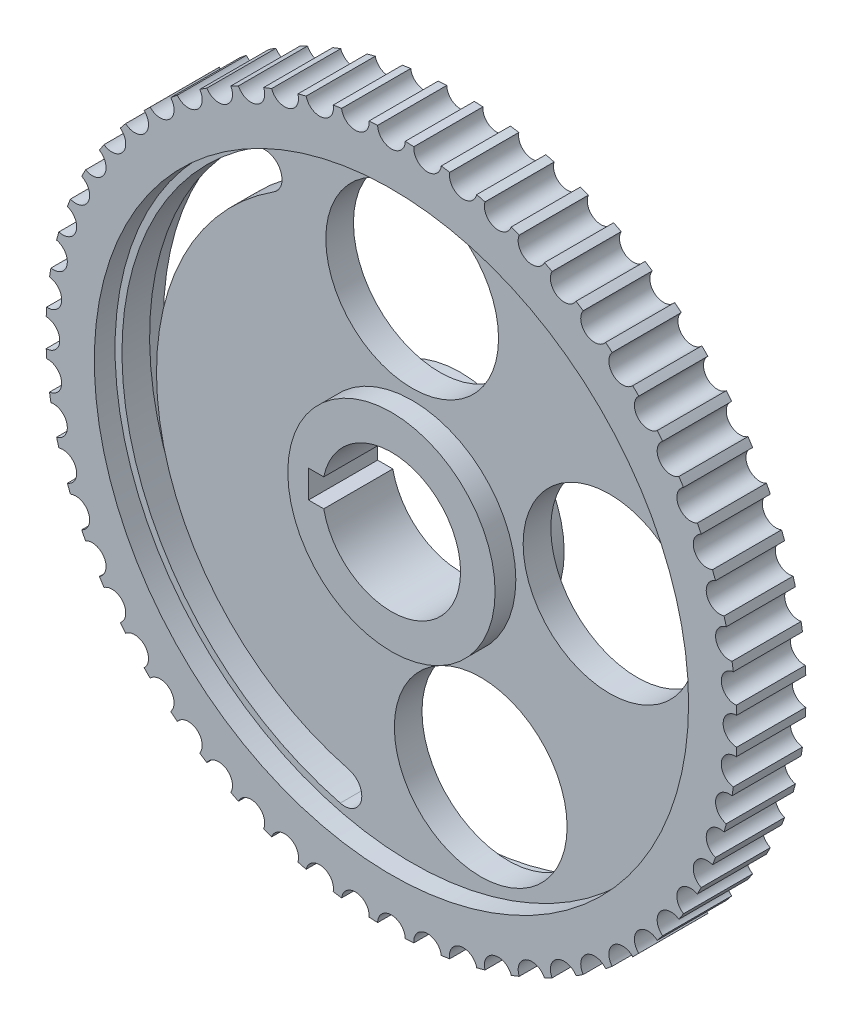
from build123d import *

# Parameters (mm, degrees)
SKETCH1_R           = 50
BOSS_EXTRUDE1_DEPTH = 10
SKETCH2_R           = 2
CUT_EXTRUDE1_DEPTH  = 10
SKETCH3_R           = 43
CUT_EXTRUDE2_DEPTH  = 3
CUT_EXTRUDE3_START  = -3
SKETCH4_R           = 43
CUT_EXTRUDE3_DEPTH  = 3
SKETCH7_R           = 15
BOSS_EXTRUDE2_DEPTH = 3
BOSS_EXTRUDE3_START = 3
SKETCH8_R           = 15
BOSS_EXTRUDE3_DEPTH = 3
SKETCH9_R           = 12.5
CUT_EXTRUDE4_DEPTH  = 5
CUT_EXTRUDE5_DEPTH  = 5
CUT_EXTRUDE7_DEPTH  = 10


with BuildPart() as part:
    # Sketch1 → Boss-Extrude1 (new body)
    with BuildSketch(Plane.XY):
        Circle(SKETCH1_R)
    extrude(amount=BOSS_EXTRUDE1_DEPTH)

    # Sketch2 → Cut-Extrude1 (cut)
    with BuildSketch(Plane.XY.offset(10)):
        with Locations((0, 50)):
            Circle(SKETCH2_R)
        with Locations((5.226423163, 49.726094768)):
            Circle(SKETCH2_R)
        with Locations((10.395584541, 48.907380037)):
            Circle(SKETCH2_R)
        with Locations((15.450849719, 47.552825815)):
            Circle(SKETCH2_R)
        with Locations((20.336832154, 45.677272882)):
            Circle(SKETCH2_R)
        with Locations((25, 43.301270189)):
            Circle(SKETCH2_R)
        with Locations((29.389262615, 40.450849719)):
            Circle(SKETCH2_R)
        with Locations((33.456530318, 37.157241274)):
            Circle(SKETCH2_R)
        with Locations((37.157241274, 33.456530318)):
            Circle(SKETCH2_R)
        with Locations((40.450849719, 29.389262615)):
            Circle(SKETCH2_R)
        with Locations((43.301270189, 25)):
            Circle(SKETCH2_R)
        with Locations((45.677272882, 20.336832154)):
            Circle(SKETCH2_R)
        with Locations((47.552825815, 15.450849719)):
            Circle(SKETCH2_R)
        with Locations((48.907380037, 10.395584541)):
            Circle(SKETCH2_R)
        with Locations((49.726094768, 5.226423163)):
            Circle(SKETCH2_R)
        with Locations((50, 0)):
            Circle(SKETCH2_R)
        with Locations((49.726094768, -5.226423163)):
            Circle(SKETCH2_R)
        with Locations((48.907380037, -10.395584541)):
            Circle(SKETCH2_R)
        with Locations((47.552825815, -15.450849719)):
            Circle(SKETCH2_R)
        with Locations((45.677272882, -20.336832154)):
            Circle(SKETCH2_R)
        with Locations((43.301270189, -25)):
            Circle(SKETCH2_R)
        with Locations((40.450849719, -29.389262615)):
            Circle(SKETCH2_R)
        with Locations((37.157241274, -33.456530318)):
            Circle(SKETCH2_R)
        with Locations((33.456530318, -37.157241274)):
            Circle(SKETCH2_R)
        with Locations((29.389262615, -40.450849719)):
            Circle(SKETCH2_R)
        with Locations((25, -43.301270189)):
            Circle(SKETCH2_R)
        with Locations((20.336832154, -45.677272882)):
            Circle(SKETCH2_R)
        with Locations((15.450849719, -47.552825815)):
            Circle(SKETCH2_R)
        with Locations((10.395584541, -48.907380037)):
            Circle(SKETCH2_R)
        with Locations((5.226423163, -49.726094768)):
            Circle(SKETCH2_R)
        with Locations((0, -50)):
            Circle(SKETCH2_R)
        with Locations((-5.226423163, -49.726094768)):
            Circle(SKETCH2_R)
        with Locations((-10.395584541, -48.907380037)):
            Circle(SKETCH2_R)
        with Locations((-15.450849719, -47.552825815)):
            Circle(SKETCH2_R)
        with Locations((-20.336832154, -45.677272882)):
            Circle(SKETCH2_R)
        with Locations((-25, -43.301270189)):
            Circle(SKETCH2_R)
        with Locations((-29.389262615, -40.450849719)):
            Circle(SKETCH2_R)
        with Locations((-33.456530318, -37.157241274)):
            Circle(SKETCH2_R)
        with Locations((-37.157241274, -33.456530318)):
            Circle(SKETCH2_R)
        with Locations((-40.450849719, -29.389262615)):
            Circle(SKETCH2_R)
        with Locations((-43.301270189, -25)):
            Circle(SKETCH2_R)
        with Locations((-45.677272882, -20.336832154)):
            Circle(SKETCH2_R)
        with Locations((-47.552825815, -15.450849719)):
            Circle(SKETCH2_R)
        with Locations((-48.907380037, -10.395584541)):
            Circle(SKETCH2_R)
        with Locations((-49.726094768, -5.226423163)):
            Circle(SKETCH2_R)
        with Locations((-50, 0)):
            Circle(SKETCH2_R)
        with Locations((-49.726094768, 5.226423163)):
            Circle(SKETCH2_R)
        with Locations((-48.907380037, 10.395584541)):
            Circle(SKETCH2_R)
        with Locations((-47.552825815, 15.450849719)):
            Circle(SKETCH2_R)
        with Locations((-45.677272882, 20.336832154)):
            Circle(SKETCH2_R)
        with Locations((-43.301270189, 25)):
            Circle(SKETCH2_R)
        with Locations((-40.450849719, 29.389262615)):
            Circle(SKETCH2_R)
        with Locations((-37.157241274, 33.456530318)):
            Circle(SKETCH2_R)
        with Locations((-33.456530318, 37.157241274)):
            Circle(SKETCH2_R)
        with Locations((-29.389262615, 40.450849719)):
            Circle(SKETCH2_R)
        with Locations((-25, 43.301270189)):
            Circle(SKETCH2_R)
        with Locations((-20.336832154, 45.677272882)):
            Circle(SKETCH2_R)
        with Locations((-15.450849719, 47.552825815)):
            Circle(SKETCH2_R)
        with Locations((-10.395584541, 48.907380037)):
            Circle(SKETCH2_R)
        with Locations((-5.226423163, 49.726094768)):
            Circle(SKETCH2_R)
    extrude(amount=-CUT_EXTRUDE1_DEPTH, mode=Mode.SUBTRACT)

    # Sketch3 → Cut-Extrude2 (cut)
    with BuildSketch(Plane.XY.offset(10)):
        Circle(SKETCH3_R)
    extrude(amount=-CUT_EXTRUDE2_DEPTH, mode=Mode.SUBTRACT)

    # Sketch4 → Cut-Extrude3 (cut)
    with BuildSketch(Plane(origin=(0, 0, 0), x_dir=(-1, 0, 0), z_dir=(0, 0, -1)).offset(CUT_EXTRUDE3_START)):
        with Locations(Location((0, 0, 0), (0, 0, 180))):
            Circle(SKETCH4_R)
    extrude(amount=CUT_EXTRUDE3_DEPTH, mode=Mode.SUBTRACT)

    # Sketch7 → Boss-Extrude2 (add)
    with BuildSketch(Plane.XY.offset(7)):
        Circle(SKETCH7_R)
    extrude(amount=BOSS_EXTRUDE2_DEPTH)

    # Sketch8 → Boss-Extrude3 (add)
    with BuildSketch(Plane(origin=(0, 0, 3), x_dir=(-1, 0, 0), z_dir=(0, 0, -1)).offset(BOSS_EXTRUDE3_START)):
        with Locations(Location((0, 0, 0), (0, 0, 180))):
            Circle(SKETCH8_R)
    extrude(amount=-BOSS_EXTRUDE3_DEPTH)

    # Sketch9 → Cut-Extrude4 (cut)
    with BuildSketch(Plane(origin=(0, 0, 3), x_dir=(-1, 0, 0), z_dir=(0, 0, -1))):
        with Locations((0, 29)):
            Circle(SKETCH9_R)
        with Locations((-28.559424837, 5.035797152)):
            Circle(SKETCH9_R)
        with Locations((-9.918584156, -27.251086003)):
            Circle(SKETCH9_R)
    extrude(amount=-CUT_EXTRUDE4_DEPTH, mode=Mode.SUBTRACT)

    # Sketch10 → Cut-Extrude5 (cut)
    with BuildSketch(Plane(origin=(0, 0, 3), x_dir=(-1, 0, 0), z_dir=(0, 0, -1))):
        with BuildLine():
            ThreePointArc((19.987822366, 31.136585508), (36.526926332, -5.89776676), (9.172746005, -35.844954048))
            ThreePointArc((9.172746005, -35.844954048), (7.370569786, -38.886690538), (10.412306276, -40.688866758))
            ThreePointArc((10.412306276, -40.688866758), (41.462997458, -6.694762268), (22.688879442, 35.344232198))
            ThreePointArc((22.688879442, 35.344232198), (19.234527559, 34.590937391), (19.987822366, 31.136585508))
        make_face()
    extrude(amount=-CUT_EXTRUDE5_DEPTH, mode=Mode.SUBTRACT)

    # Sketch11 → Cut-Extrude7 (cut)
    with BuildSketch(Plane(origin=(0, 0, 0), x_dir=(-1, 0, 0), z_dir=(0, 0, -1))):
        with BuildLine():
            Line((8, -2), (8, 2))
            Line((8, 2), (9.797958971, 2))
            ThreePointArc((9.797958971, 2), (-10, 0), (9.797958971, -2))
            Line((9.797958971, -2), (8, -2))
        make_face()
        with BuildLine():
            Line((9.797958971, 2), (8, 2))
            Line((8, 2), (8, -2))
            Line((8, -2), (9.797958971, -2))
            ThreePointArc((9.797958971, -2), (9.94936153, -1.00508962), (10, 0))
            ThreePointArc((10, 0), (9.94936153, 1.00508962), (9.797958971, 2))
        make_face()
        with BuildLine():
            Line((12, 2), (9.797958971, 2))
            ThreePointArc((9.797958971, 2), (9.94936153, 1.00508962), (10, 0))
            ThreePointArc((10, 0), (9.94936153, -1.00508962), (9.797958971, -2))
            Line((9.797958971, -2), (12, -2))
            Line((12, -2), (12, 2))
        make_face()
    extrude(amount=-CUT_EXTRUDE7_DEPTH, mode=Mode.SUBTRACT)


solid = part.part
